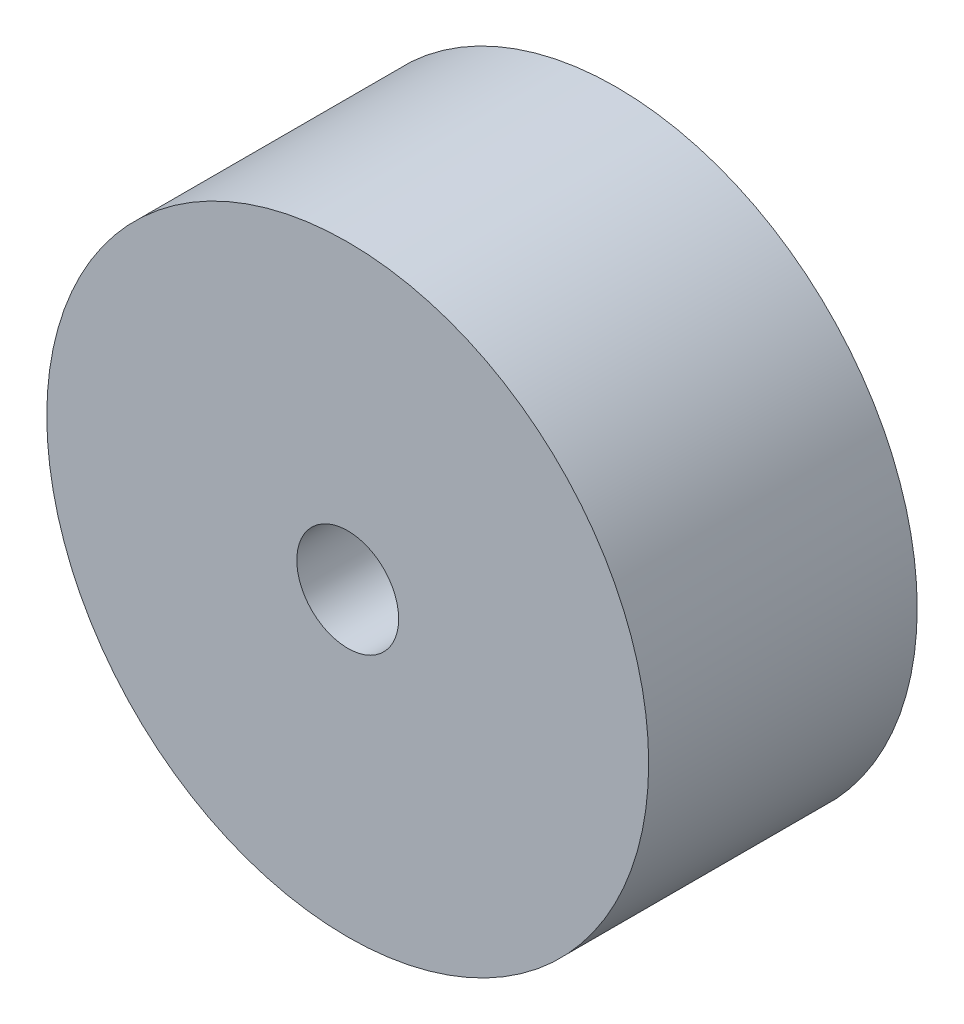
from build123d import *

# Parameters (mm, degrees)
SKETCH1_R           = 6.5
BOSS_EXTRUDE1_DEPTH = 5.8
SKETCH2_R           = 4.8
CUT_EXTRUDE1_DEPTH  = 1.5875
SKETCH3_R           = 1
BOSS_EXTRUDE2_DEPTH = 1.5875
SKETCH4_R           = 1.525
BOSS_EXTRUDE3_DEPTH = 3
SKETCH5_R           = 0.85
CUT_EXTRUDE2_DEPTH  = 37.973494724
SKETCH6_R           = 1.1
CUT_EXTRUDE3_DEPTH  = 3
FILLET1_R           = 0.2


with BuildPart() as part:
    # Sketch1 → Boss-Extrude1 (new body)
    with BuildSketch(Plane.XY):
        with Locations((-29.082250471, -1.703826149)):
            Circle(SKETCH1_R)
    extrude(amount=BOSS_EXTRUDE1_DEPTH)

    # Sketch2 → Cut-Extrude1 (cut)
    with BuildSketch(Plane(origin=(0, 0, 0), x_dir=(-1, 0, 0), z_dir=(0, 0, -1))):
        with Locations((29.082250471, -1.703826149)):
            Circle(SKETCH2_R)
    extrude(amount=-CUT_EXTRUDE1_DEPTH, mode=Mode.SUBTRACT)

    # Sketch3 → Boss-Extrude2 (add)
    with BuildSketch(Plane(origin=(0, 0, 1.5875), x_dir=(-1, 0, 0), z_dir=(0, 0, -1))):
        with Locations((29.082250471, -1.703826149)):
            Circle(SKETCH3_R)
    extrude(amount=BOSS_EXTRUDE2_DEPTH)

    # Sketch4 → Boss-Extrude3 (add)
    with BuildSketch(Plane(origin=(0, 0, 0), x_dir=(-1, 0, 0), z_dir=(0, 0, -1))):
        with Locations((29.082250471, -1.703826149)):
            Circle(SKETCH4_R)
    extrude(amount=-BOSS_EXTRUDE3_DEPTH)

    # Sketch5 → Cut-Extrude2 (cut, through all)
    with BuildSketch(Plane(origin=(0, 0, 0), x_dir=(-1, 0, 0), z_dir=(0, 0, -1))):
        with Locations((29.082250471, -1.703826149)):
            Circle(SKETCH5_R)
    extrude(amount=-CUT_EXTRUDE2_DEPTH, mode=Mode.SUBTRACT)

    # Sketch6 → Cut-Extrude3 (cut)
    with BuildSketch(Plane.XY.offset(5.8)):
        with Locations((-29.082250471, -1.703826149)):
            Circle(SKETCH6_R)
    extrude(amount=-CUT_EXTRUDE3_DEPTH, mode=Mode.SUBTRACT)

    # Fillet1
    fillet1_edges = [part.edges().sort_by_distance(p)[0] for p in [
        (-27.557250471, -1.703826149, 0),
    ]]
    fillet(fillet1_edges, radius=FILLET1_R)


solid = part.part
